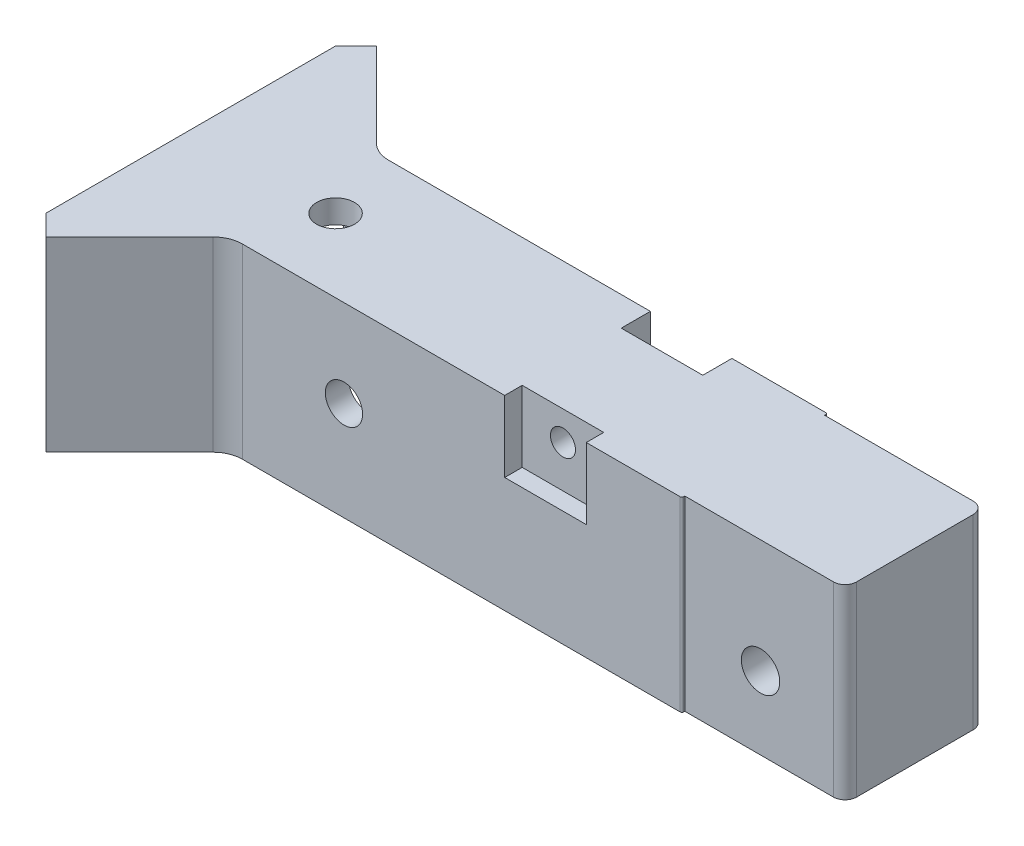
from build123d import *

# Parameters (mm, degrees)
BOSS_EXTRUDE1_DEPTH     = 27
SKETCH2_R               = 3.25
BOSS_EXTRUDE2_DEPTH     = 5
CUT_EXTRUDE1_DEPTH      = 92.228395409
CUT_EXTRUDE1_DEPTH_BACK = 92.228395409
SKETCH3_R               = 3.2
SKETCH4_W               = 10
SKETCH4_H               = 5
SKETCH4_H_2             = 3
CUT_EXTRUDE2_DEPTH      = 10.2
CUT_EXTRUDE3_DEPTH      = 90.058122159
CUT_EXTRUDE3_DEPTH_BACK = 90.058122159
SKETCH5_R               = 2.15
CUT_EXTRUDE4_DEPTH      = 92.183595829
CUT_EXTRUDE4_DEPTH_BACK = 92.183595829
SKETCH6_R               = 3.3
CUT_EXTRUDE5_START      = 9.55
SKETCH8_W               = 14
SKETCH8_H               = 14.4
CUT_EXTRUDE5_DEPTH      = 10
CUT_EXTRUDE6_START      = -7.45
SKETCH8_2_W             = 14
SKETCH8_2_H             = 14.4
CUT_EXTRUDE6_DEPTH      = 10
CUT_EXTRUDE7_DEPTH      = 87.332404543
CUT_EXTRUDE8_START      = -1
CUT_EXTRUDE8_DEPTH      = 86.163733723
FILLET3_R               = 5
FILLET4_R               = 2
FILLET5_R               = 0.3


with BuildPart() as part:
    # Sketch1 → Boss-Extrude1 (new body)
    with BuildSketch(Plane(origin=(0, 0, 0), x_dir=(1, 0, 0), z_dir=(0, 1, 0))):
        Polygon((0, 7.55), (-32.6, 7.55), (-49.874368671, 24.824368671), (-46.338834765, 28.359902577), (-30.428932188, 12.45), (75, 12.45), (75, -12.55), (-30.528932188, -12.55), (-46.338834765, -28.359902577), (-49.874368671, -24.824368671), (-32.6, -7.55), (0, -7.55), align=None)
    extrude(amount=BOSS_EXTRUDE1_DEPTH)

    # Sketch2 → Boss-Extrude2 (add)
    with BuildSketch(Plane(origin=(0, 27, 0), x_dir=(1, 0, 0), z_dir=(0, 1, 0))):
        Polygon((-49.874368671, 24.824368671), (-49.874368671, -24.824368671), (-46.338834765, -28.359902577), (-30.528932188, -12.55), (75, -12.55), (75, 12.45), (-30.428932188, 12.45), (-46.338834765, 28.359902577), align=None)
        with Locations(Location((-25, 0, 0), (0, 0, 270))):
            Circle(SKETCH2_R, mode=Mode.SUBTRACT)
    extrude(amount=BOSS_EXTRUDE2_DEPTH)

    # Sketch3 → Cut-Extrude1 (cut, two sides: drawn at the far end of the back side and taken through both)
    with BuildSketch(Plane.XY.offset(12.55).offset(-CUT_EXTRUDE1_DEPTH_BACK)):
        with Locations((-11, 17)):
            Circle(SKETCH3_R)
    extrude(amount=CUT_EXTRUDE1_DEPTH + CUT_EXTRUDE1_DEPTH_BACK, mode=Mode.SUBTRACT)

    # Sketch4 → Cut-Extrude2 (cut)
    with BuildSketch(Plane(origin=(0, 32, 0), x_dir=(1, 0, 0), z_dir=(0, 1, 0))):
        with Locations((23.58571545, 9.95)):
            Rectangle(SKETCH4_W, SKETCH4_H)
        with Locations((23.58571545, -11.05)):
            Rectangle(SKETCH4_W, SKETCH4_H_2)
    extrude(amount=-CUT_EXTRUDE2_DEPTH, mode=Mode.SUBTRACT)

    # Sketch5 → Cut-Extrude3 (cut, two sides: drawn at the far end of the back side and taken through both)
    with BuildSketch(Plane(origin=(0, 0, -7.45), x_dir=(-1, 0, 0), z_dir=(0, 0, -1)).offset(-CUT_EXTRUDE3_DEPTH_BACK)):
        with Locations((-23.58571545, 27)):
            Circle(SKETCH5_R)
    extrude(amount=CUT_EXTRUDE3_DEPTH + CUT_EXTRUDE3_DEPTH_BACK, mode=Mode.SUBTRACT)

    # Sketch6 → Cut-Extrude4 (cut, two sides: drawn at the far end of the back side and taken through both)
    with BuildSketch(Plane(origin=(0, 0, -12.45), x_dir=(-1, 0, 0), z_dir=(0, 0, -1)).offset(-CUT_EXTRUDE4_DEPTH_BACK)):
        with Locations((-60, 12.5)):
            Circle(SKETCH6_R)
    extrude(amount=CUT_EXTRUDE4_DEPTH + CUT_EXTRUDE4_DEPTH_BACK, mode=Mode.SUBTRACT)

    # Sketch8 → Cut-Extrude5 (cut)
    with BuildSketch(Plane.XY.offset(CUT_EXTRUDE5_START)):
        with Locations((23.58571545, 27)):
            Rectangle(SKETCH8_W, SKETCH8_H)
    extrude(amount=CUT_EXTRUDE5_DEPTH, mode=Mode.SUBTRACT)

    # Sketch8<2> → Cut-Extrude6 (cut)
    with BuildSketch(Plane.XY.offset(CUT_EXTRUDE6_START)):
        with Locations((23.58571545, 27)):
            Rectangle(SKETCH8_2_W, SKETCH8_2_H)
    extrude(amount=-CUT_EXTRUDE6_DEPTH, mode=Mode.SUBTRACT)

    # Sketch9 → Cut-Extrude7 (cut, through all)
    with BuildSketch(Plane.XZ):
        Polygon((75, 12.55), (47, 12.55), (47, 12.05), (74.5, 12.05), (74.5, -11.95), (47, -11.95), (47, -12.45), (75, -12.45), (75, -11.95), (75, 12.05), align=None)
    extrude(amount=-CUT_EXTRUDE7_DEPTH, mode=Mode.SUBTRACT)

    # Sketch10 → Cut-Extrude8 (cut, through all)
    with BuildSketch(Plane.XZ.offset(-27).offset(CUT_EXTRUDE8_START)):
        Polygon((-50.874368671, 27.238582233), (-50.874368671, -27.238582233), (-32.185786438, -8.55), (1, -8.55), (1, 8.55), (-32.185786438, 8.55), align=None)
    extrude(amount=CUT_EXTRUDE8_DEPTH, mode=Mode.SUBTRACT)

    # Fillet3
    fillet3_edges = [part.edges().sort_by_distance(p)[0] for p in [
        (-30.428932188, 16, -12.45),
        (-30.528932188, 16, 12.55),
    ]]
    fillet(fillet3_edges, radius=FILLET3_R)

    # Fillet4
    fillet4_edges = [part.edges().sort_by_distance(p)[0] for p in [
        (74.5, 16, 12.05),
        (74.5, 16, -11.95),
    ]]
    fillet(fillet4_edges, radius=FILLET4_R)

    # Fillet5
    fillet5_edges = [part.edges().sort_by_distance(p)[0] for p in [
        (47, 16, 12.55),
        (47, 16, -12.45),
    ]]
    fillet(fillet5_edges, radius=FILLET5_R)


solid = part.part
